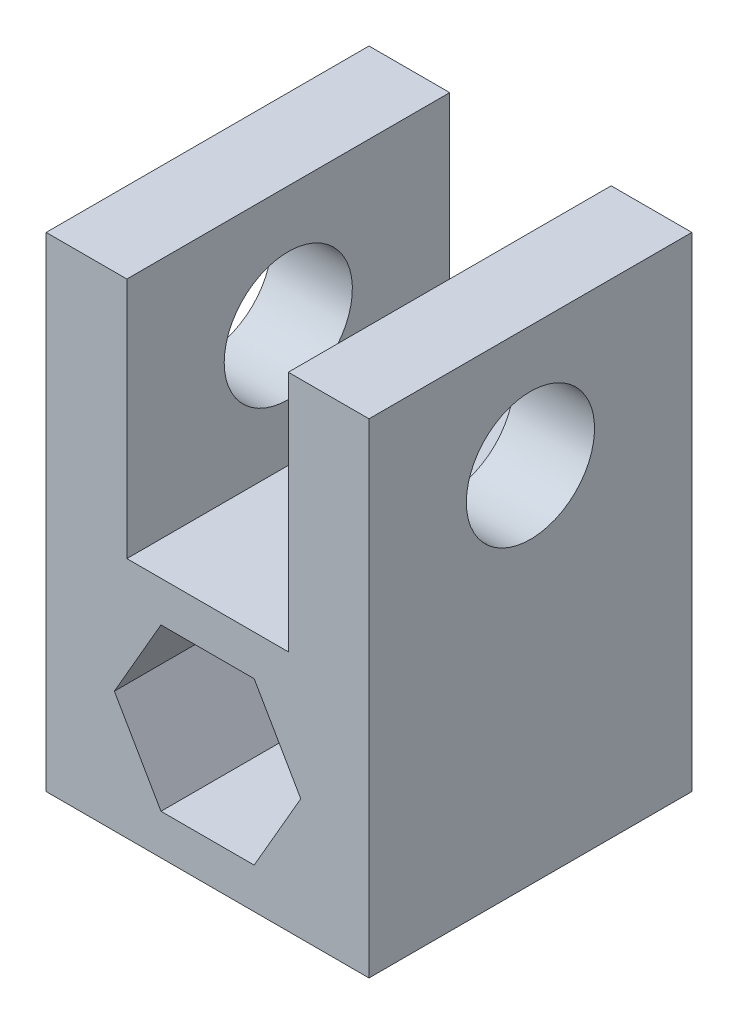
from build123d import *

# Parameters (mm, degrees)
BOSS_EXTRUDE1_DEPTH     = 25.4
CUT_EXTRUDE1_DEPTH      = 48.519048812
F_3_8_CLEARANCE_HOLE1_D = 10.0838


with BuildPart() as part:
    # Sketch1 → Boss-Extrude1 (new body)
    with BuildSketch(Plane.XY):
        Polygon((-12.7, 0), (12.7, 0), (12.7, 38.1), (6.35, 38.1), (6.35, 19.05), (-6.35, 19.05), (-6.35, 38.1), (-12.7, 38.1), align=None)
    extrude(amount=BOSS_EXTRUDE1_DEPTH)

    # Sketch2 → Cut-Extrude1 (cut, through all)
    with BuildSketch(Plane.XY.offset(25.4)):
        Polygon((3.666174209, 15.875), (-3.666174209, 15.875), (-7.332348419, 9.525), (-3.666174209, 3.175), (3.666174209, 3.175), (7.332348419, 9.525), align=None)
    extrude(amount=-CUT_EXTRUDE1_DEPTH, mode=Mode.SUBTRACT)

    # 3/8 Clearance Hole1 (through all)
    with Locations(Plane.ZY.offset(12.7)):
        with Locations((12.7, 28.575)):
            Hole(F_3_8_CLEARANCE_HOLE1_D / 2)


solid = part.part
